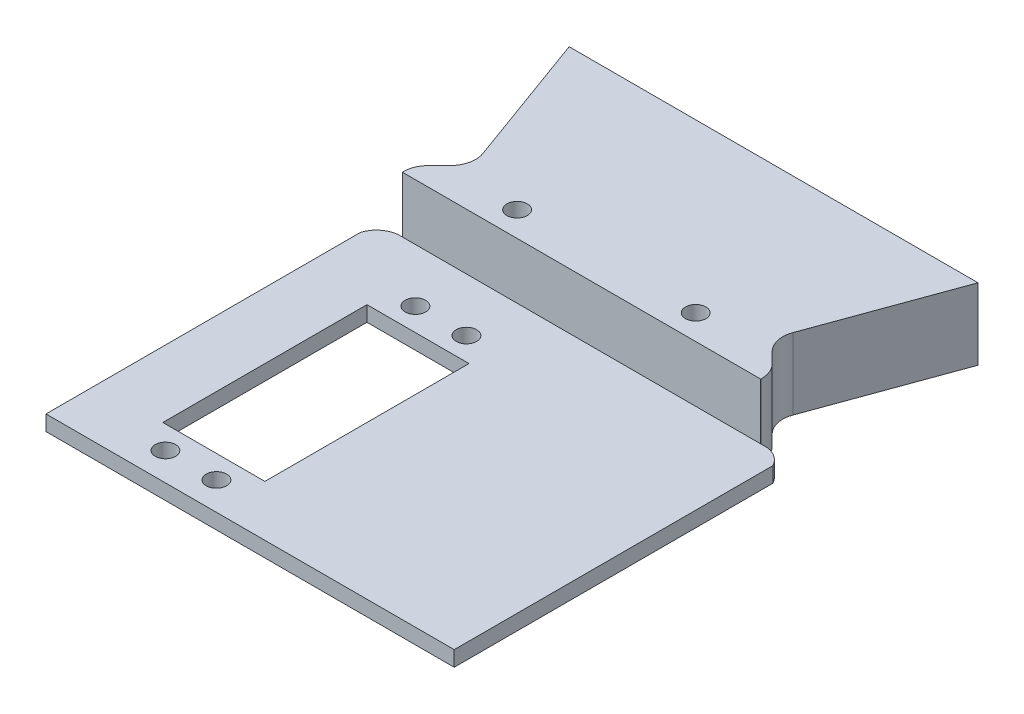
from build123d import *

# Parameters (mm, degrees)
BOSS_EXTRUDE1_DEPTH        = 3
BOSS_EXTRUDE5_DEPTH        = 3
CROQUIS1_R                 = 2
CORTAR_EXTRUIR1_DEPTH      = 10
SALIENTE_EXTRUIR1_DEPTH    = 3
CORTAR_EXTRUIR2_DEPTH      = 54.947125886
CORTAR_EXTRUIR2_DEPTH_BACK = 10
CORTAR_EXTRUIR3_DEPTH      = 10
CROQUIS6_R                 = 9.410860806
CROQUIS6_R_2               = 2
SALIENTE_EXTRUIR2_DEPTH    = 11
CROQUIS8_W                 = 80.002595972
CROQUIS8_H                 = 3
SALIENTE_EXTRUIR3_DEPTH    = 33.83
CROQUIS9_R                 = 1.5
CORTAR_EXTRUIR7_DEPTH      = 33.83
CROQUIS9_3_R               = 2
CORTAR_EXTRUIR8_DEPTH      = 33.83


with BuildPart() as part:
    # Sketch1 → Boss-Extrude1 (new body)
    with BuildSketch(Plane(origin=(0, 0, 0), x_dir=(1, 0, 0), z_dir=(0, 1, 0))):
        with BuildLine():
            Line((-30.38926404, 6.174917902), (-40.065448474, 32.76001614))
            Line((-40.065448474, 32.76001614), (40.065448474, 32.76001614))
            Line((40.065448474, 32.76001614), (30.38926404, 6.174917902))
            ThreePointArc((30.38926404, 6.174917902), (30.206247108, 3.382619115), (31.552193238, 0.929283279))
            Line((31.552193238, 0.929283279), (33.658129878, -1.17665336))
            ThreePointArc((33.658129878, -1.17665336), (34.741993634, -2.798770105), (35.122595972, -4.712187266))
            Line((35.122595972, -4.712187266), (35.122595972, -23.310725409))
            Line((35.122595972, -23.310725409), (-35.122595972, -23.310725409))
            Line((-35.122595972, -23.310725409), (-35.122595972, -4.712187266))
            ThreePointArc((-35.122595972, -4.712187266), (-34.741993634, -2.798770105), (-33.658129878, -1.17665336))
            Line((-33.658129878, -1.17665336), (-31.552193238, 0.929283279))
            ThreePointArc((-31.552193238, 0.929283279), (-30.206247108, 3.382619115), (-30.38926404, 6.174917902))
        make_face()
    extrude(amount=BOSS_EXTRUDE1_DEPTH)

    # Sketch8 → Boss-Extrude5 (add)
    with BuildSketch(Plane(origin=(0, 3, 0), x_dir=(1, 0, 0), z_dir=(0, 1, 0))):
        Polygon((-35.122595972, -23.310725409), (35.122595972, -23.310725409), (25.122595972, -33.310725409), (-25.122595972, -33.310725409), align=None)
    extrude(amount=-BOSS_EXTRUDE5_DEPTH)

    # Croquis1 → Cortar-Extruir1 (cut)
    with BuildSketch(Plane(origin=(0, 3, 0), x_dir=(1, 0, 0), z_dir=(0, 1, 0))):
        with Locations(Location((-17.5, 1.614e-05, 0), (0, 0, 270))):
            Circle(CROQUIS1_R)
        with Locations(Location((17.5, 1.614e-05, 0), (0, 0, 270))):
            Circle(CROQUIS1_R)
    extrude(amount=-CORTAR_EXTRUIR1_DEPTH, mode=Mode.SUBTRACT)

    # Croquis2 → Saliente-Extruir1 (add)
    with BuildSketch(Plane(origin=(0, 3, 0), x_dir=(1, 0, 0), z_dir=(0, 1, 0))):
        Polygon((17, -36.000725409), (40.002595972, -36.000725409), (40.002595972, -33.000725409), (40.002595972, -4.877263675), (-40, -4.877263675), (-40, -36.000725409), align=None)
    extrude(amount=-SALIENTE_EXTRUIR1_DEPTH)

    # Croquis3 → Cortar-Extruir2 (cut, two sides: drawn at the far end of the back side and taken through both)
    with BuildSketch(Plane(origin=(0, 3, 0), x_dir=(1, 0, 0), z_dir=(0, 1, 0)).offset(-CORTAR_EXTRUIR2_DEPTH_BACK)):
        with BuildLine():
            ThreePointArc((36.503682563, -4.877263675), (38.558949602, -5.711743064), (40.002595972, -7.395893774))
            Line((40.002595972, -7.395893774), (40.002595972, -4.877263675))
            Line((40.002595972, -4.877263675), (36.503682563, -4.877263675))
        make_face()
    extrude(amount=CORTAR_EXTRUIR2_DEPTH + CORTAR_EXTRUIR2_DEPTH_BACK, mode=Mode.SUBTRACT)

    # Croquis4 → Cortar-Extruir3 (cut)
    with BuildSketch(Plane(origin=(0, 3, 0), x_dir=(1, 0, 0), z_dir=(0, 1, 0))):
        with BuildLine():
            ThreePointArc((-40, -8.223896962), (-38.452234257, -5.909741818), (-35.866720439, -4.877263675))
            Line((-35.866720439, -4.877263675), (-40, -4.877263675))
            Line((-40, -4.877263675), (-40, -8.223896962))
        make_face()
    extrude(amount=-CORTAR_EXTRUIR3_DEPTH, mode=Mode.SUBTRACT)

    # Croquis6 → Saliente-Extruir2 (add)
    # profile 1 of 2: a face of its own
    with BuildSketch(Plane(origin=(0, 3, 0), x_dir=(1, 0, 0), z_dir=(0, 1, 0))):
        with BuildLine():
            Line((-35.122595972, -4.877263675), (35.122595972, -4.877263675))
            Line((35.122595972, -4.877263675), (35.122595972, -4.712187266))
            ThreePointArc((35.122595972, -4.712187266), (34.741993634, -2.798770105), (33.658129878, -1.17665336))
            Line((33.658129878, -1.17665336), (31.552193238, 0.929283279))
            ThreePointArc((31.552193238, 0.929283279), (30.206247108, 3.382619115), (30.38926404, 6.174917902))
            Line((30.38926404, 6.174917902), (40.065448474, 32.76001614))
            Line((40.065448474, 32.76001614), (-40.065448474, 32.76001614))
            Line((-40.065448474, 32.76001614), (-30.38926404, 6.174917902))
            ThreePointArc((-30.38926404, 6.174917902), (-30.206247108, 3.382619115), (-31.552193238, 0.929283279))
            Line((-31.552193238, 0.929283279), (-33.658129878, -1.17665336))
            ThreePointArc((-33.658129878, -1.17665336), (-34.741993634, -2.798770105), (-35.122595972, -4.712187266))
            Line((-35.122595972, -4.712187266), (-35.122595972, -4.877263675))
        make_face()
        with Locations((-16.715825215, 19.994936592)):
            Circle(CROQUIS6_R, mode=Mode.SUBTRACT)
        with Locations(Location((-17.5, 1.614e-05, 0), (0, 0, 270))):
            Circle(CROQUIS6_R_2, mode=Mode.SUBTRACT)
        with Locations(Location((17.5, 1.614e-05, 0), (0, 0, 270))):
            Circle(CROQUIS6_R_2, mode=Mode.SUBTRACT)
    # profile 2 of 2: a face of its own
    with BuildSketch(Plane(origin=(0, 3, 0), x_dir=(1, 0, 0), z_dir=(0, 1, 0))):
        with Locations((-16.715825215, 19.994936592)):
            Circle(CROQUIS6_R)
    extrude(amount=SALIENTE_EXTRUIR2_DEPTH)

    # Croquis8 → Saliente-Extruir3 (add)
    with BuildSketch(Plane.XY.offset(36.000725409)):
        with Locations((0.001297986, 1.5)):
            Rectangle(CROQUIS8_W, CROQUIS8_H)
    extrude(amount=SALIENTE_EXTRUIR3_DEPTH)

    # Croquis9 → Cortar-Extruir7 (cut)
    # profile 1 of 2: a face of its own
    with BuildSketch(Plane(origin=(0, 3, 0), x_dir=(1, 0, 0), z_dir=(0, 1, 0))):
        Polygon((-7.6, -19.830725409), (-7.1, -19.830725409), (-7.1, -59.830725409), (-7.6, -59.830725409), (-26.6, -59.830725409), (-27.1, -59.830725409), (-27.1, -19.830725409), (-26.6, -19.830725409), align=None)
        with Locations((-17.1, -29.830725409)):
            Circle(CROQUIS9_R, mode=Mode.SUBTRACT)
    # profile 2 of 2: a face of its own
    with BuildSketch(Plane(origin=(0, 3, 0), x_dir=(1, 0, 0), z_dir=(0, 1, 0))):
        with Locations((-17.1, -29.830725409)):
            Circle(CROQUIS9_R)
    extrude(amount=-CORTAR_EXTRUIR7_DEPTH, mode=Mode.SUBTRACT)

    # Croquis9<3> → Cortar-Extruir8 (cut)
    with BuildSketch(Plane(origin=(0, 3, 0), x_dir=(1, 0, 0), z_dir=(0, 1, 0))):
        with Locations(Location((-22.1, -15.330725409, 0), (0, 0, 270))):
            Circle(CROQUIS9_3_R)
        with Locations(Location((-12.1, -15.330725409, 0), (0, 0, 270))):
            Circle(CROQUIS9_3_R)
        with Locations(Location((-22.1, -64.330725409, 0), (0, 0, 270))):
            Circle(CROQUIS9_3_R)
        with Locations(Location((-12.1, -64.330725409, 0), (0, 0, 270))):
            Circle(CROQUIS9_3_R)
    extrude(amount=-CORTAR_EXTRUIR8_DEPTH, mode=Mode.SUBTRACT)


solid = part.part
